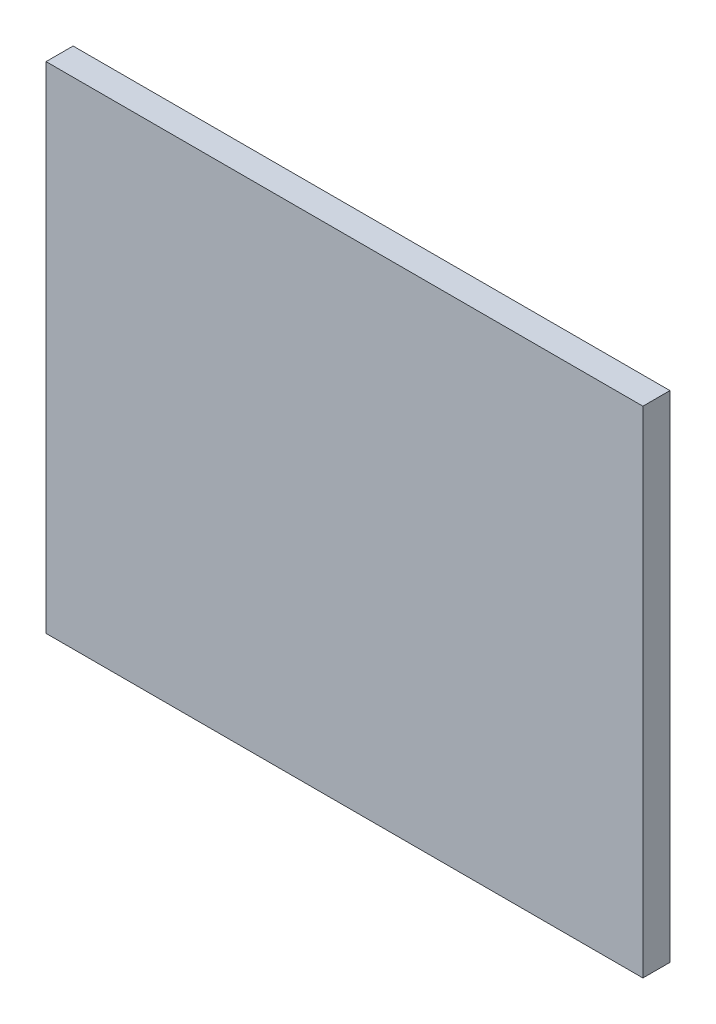
from build123d import *

# Parameters (mm, degrees)
SKETCH1_W           = 101.6
SKETCH1_H           = 84.300000056
BOSS_EXTRUDE1_DEPTH = 4.599999944


with BuildPart() as part:
    # Sketch1 → Boss-Extrude1 (new body)
    with BuildSketch(Plane.XY):
        with Locations((50.8, 42.150000028)):
            Rectangle(SKETCH1_W, SKETCH1_H)
    extrude(amount=BOSS_EXTRUDE1_DEPTH)


solid = part.part
